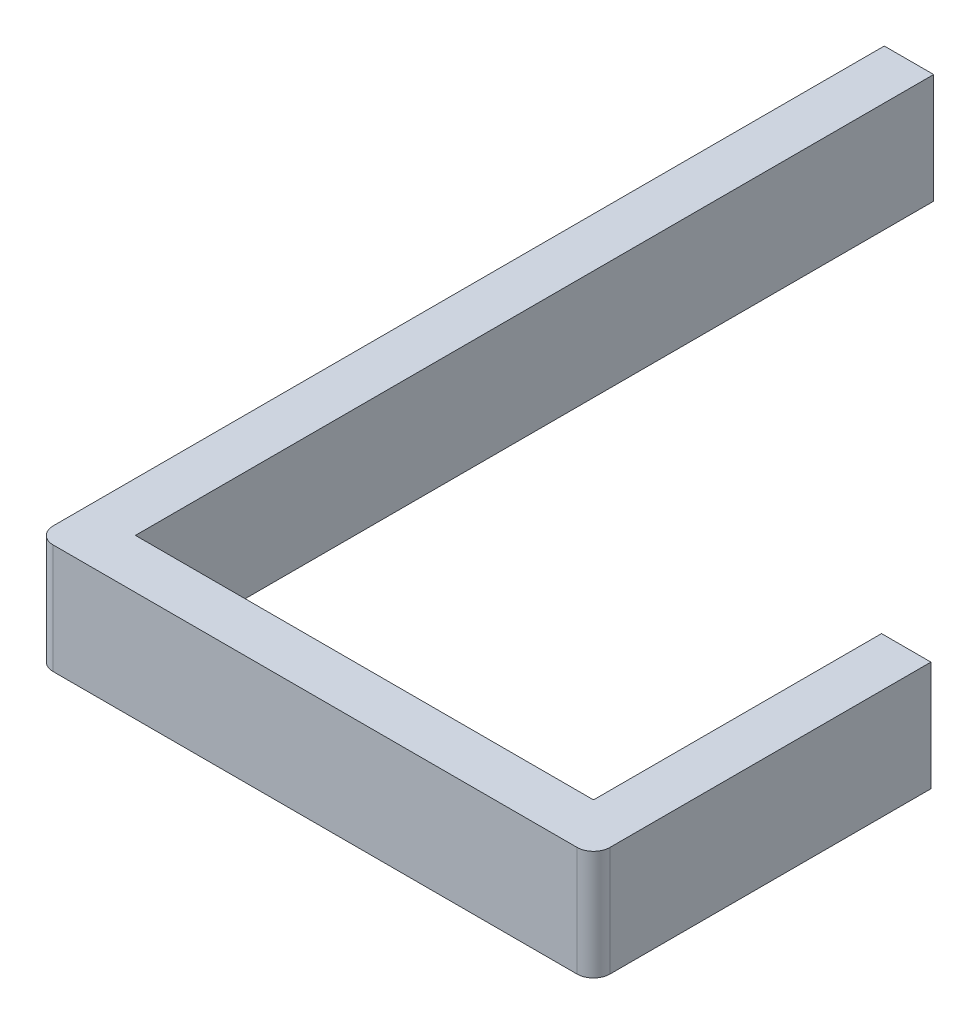
from build123d import *

# Parameters (mm, degrees)
SKETCH_1_W      = 9
SKETCH_1_H      = 105.5
EXTRUDE_1_DEPTH = 20
FILLET_1_R      = 3
SKETCH_2_W      = 40
SKETCH_2_H      = 20
EXTRUDE_2_DEPTH = 9


with BuildPart() as part:
    # 草图1 → 凸台-拉伸1 (new body)
    with BuildSketch(Plane(origin=(0, 0, 0), x_dir=(1, 0, 0), z_dir=(0, 1, 0))):
        with Locations((4.5, -52.75)):
            Rectangle(SKETCH_1_W, SKETCH_1_H)
        Polygon((9, -105.5), (0, -105.5), (0, -114.5), (92.5, -114.5), (92.5, -105.5), align=None)
        Polygon((92.5, -53), (92.5, -105.5), (92.5, -114.5), (101.5, -114.5), (101.5, -53), align=None)
    extrude(amount=EXTRUDE_1_DEPTH)

    # 圆角1
    fillet_1_edges = [part.edges().sort_by_distance(p)[0] for p in [
        (101.5, 10, 114.5),
        (0, 10, 114.5),
    ]]
    fillet(fillet_1_edges, radius=FILLET_1_R)

    # 草图2 → 凸台-拉伸2 (add)
    with BuildSketch(Plane.ZY):
        with Locations((-20, 10)):
            Rectangle(SKETCH_2_W, SKETCH_2_H)
    extrude(amount=-EXTRUDE_2_DEPTH)


solid = part.part
